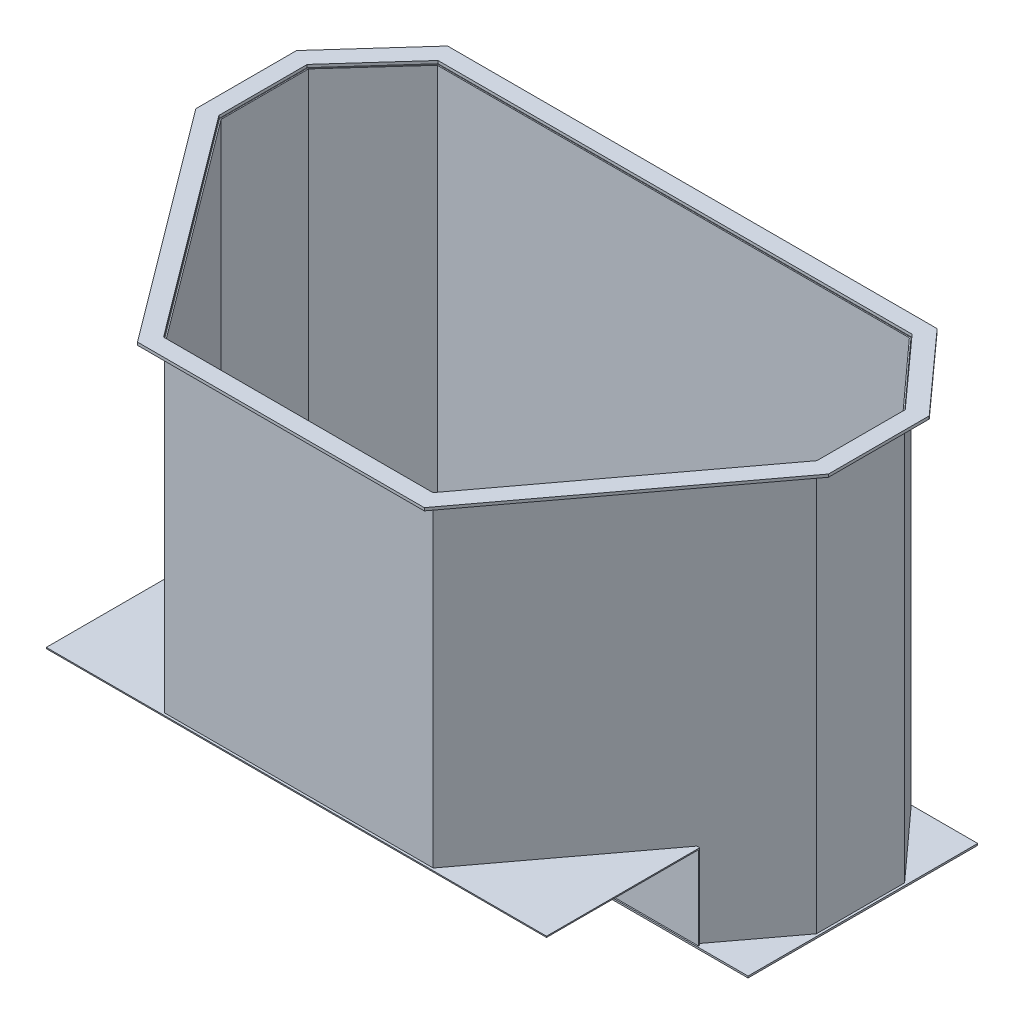
from build123d import *

# Parameters (mm, degrees)
BOSS_EXTRUDE1_DEPTH = 2890
SKETCH2_W           = 4270
SKETCH2_H           = 1630
BOSS_EXTRUDE2_DEPTH = 12
SKETCH3_W           = 3666.559691054
SKETCH3_H           = 1200.183204927
CUT_EXTRUDE1_DEPTH  = 600
BOSS_EXTRUDE3_DEPTH = 1775
BOSS_EXTRUDE4_DEPTH = 20


with BuildPart() as part:
    # Sketch1 → Boss-Extrude1 (new body)
    with BuildSketch(Plane(origin=(0, 0, 0), x_dir=(1, 0, 0), z_dir=(0, 1, 0))):
        Polygon((-1678.546411441, 798), (1678.546411441, 798), (2118, 313.085695383), (2118, -312.66207609), (954.005166622, -1868), (-954.005166622, -1868), (-2118, -312.66207609), (-2118, 313.085695383), align=None)
        Polygon((-1675, 790), (1675, 790), (2110, 310), (2110, -310), (950, -1860), (-950, -1860), (-2110, -310), (-2110, 310), align=None, mode=Mode.SUBTRACT)
    extrude(amount=BOSS_EXTRUDE1_DEPTH)

    # Sketch2 → Boss-Extrude2 (add)
    with BuildSketch(Plane.XZ):
        Rectangle(SKETCH2_W, SKETCH2_H)
    extrude(amount=BOSS_EXTRUDE2_DEPTH)

    # Sketch3 → Cut-Extrude1 (cut)
    with BuildSketch(Plane.XZ):
        with Locations((75.079734907, 1398.091602464)):
            Rectangle(SKETCH3_W, SKETCH3_H)
    extrude(amount=-CUT_EXTRUDE1_DEPTH, mode=Mode.SUBTRACT)

    # Sketch4 → Boss-Extrude3 (add, symmetric)
    with BuildSketch(Plane(origin=(0, 0, 0), x_dir=(0, 0, -1), z_dir=(1, 0, 0))):
        Polygon((-806, 592), (-806, 0), (-798, 0), (-798, 600), (-1885, 600), (-1885, 592), align=None)
    extrude(amount=BOSS_EXTRUDE3_DEPTH, both=True)


with BuildPart() as body_2:
    # Sketch5 → Boss-Extrude4 (new body)
    with BuildSketch(Plane(origin=(0, 2890, 0), x_dir=(1, 0, 0), z_dir=(0, 1, 0))):
        Polygon((-1737, 925), (1737, 925), (2245, 361), (2245, -354), (1017.5, -1995), (-1017.5, -1995), (-2245, -354), (-2245, 361), align=None)
        Polygon((-1682.249289067, 802), (1682.249289067, 802), (2122, 313.772832743), (2122, -313.086677907), (955.90243579, -1872), (-955.90243579, -1872), (-2122, -313.086677907), (-2122, 313.772832743), align=None, mode=Mode.SUBTRACT)
    extrude(amount=BOSS_EXTRUDE4_DEPTH)


solid = Compound([part.part, body_2.part])
